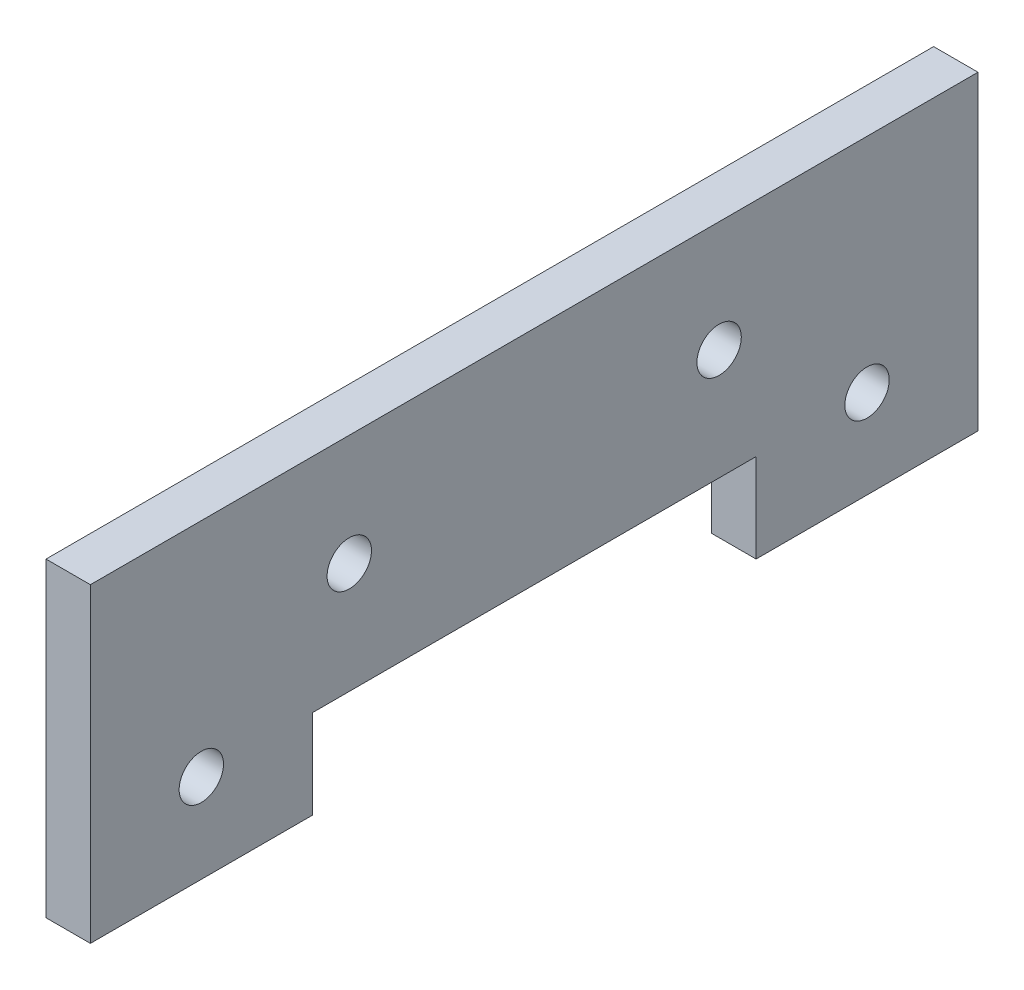
from build123d import *

# Parameters (mm, degrees)
EXTRUDE_1_DEPTH     = 3
SKETCH_2_R          = 1.5
CUT_EXTRUDE_1_DEPTH = 3


with BuildPart() as part:
    # 草图1 → 凸台-拉伸1 (new body)
    with BuildSketch(Plane(origin=(0, 0, 0), x_dir=(0, 0, -1), z_dir=(1, 0, 0))):
        Polygon((0, 0), (60, 0), (60, -21), (45, -21), (45, -15), (15, -15), (15, -21), (0, -21), align=None)
    extrude(amount=EXTRUDE_1_DEPTH)

    # 草图2 → 切除-拉伸1 (cut)
    with BuildSketch(Plane(origin=(3, 0, 0), x_dir=(0, 0, -1), z_dir=(1, 0, 0))):
        with Locations((42.5, -7.5)):
            Circle(SKETCH_2_R)
        with Locations((17.5, -7.5)):
            Circle(SKETCH_2_R)
        with Locations((52.5, -15)):
            Circle(SKETCH_2_R)
        with Locations((7.5, -15)):
            Circle(SKETCH_2_R)
    extrude(amount=-CUT_EXTRUDE_1_DEPTH, mode=Mode.SUBTRACT)


solid = part.part
